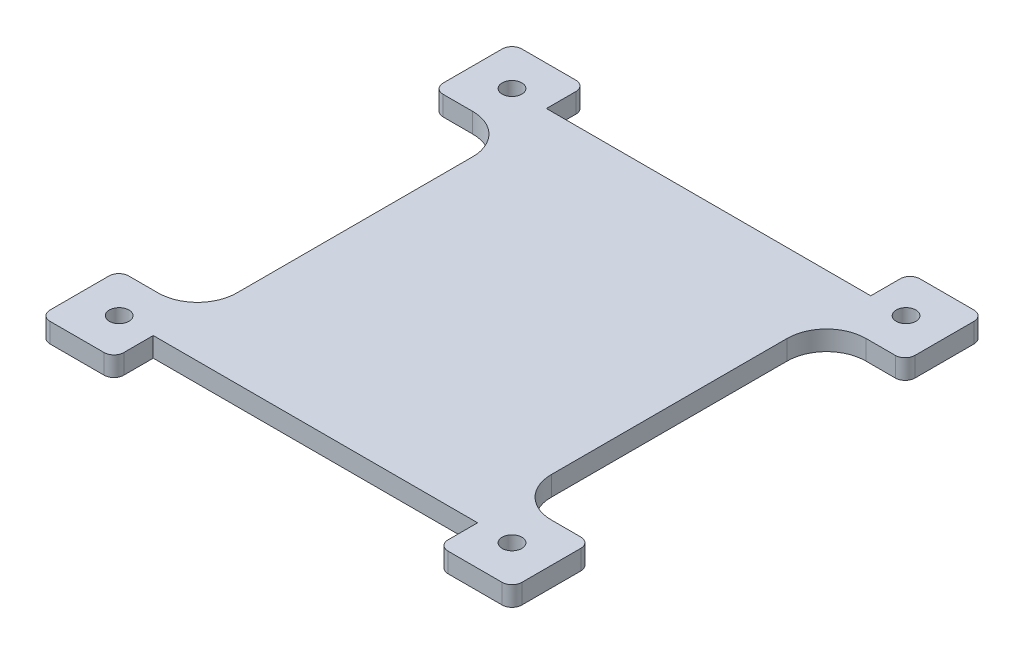
from build123d import *

# Parameters (mm, degrees)
SKETCH1_R           = 3.175
BOSS_EXTRUDE1_DEPTH = 6.35
FILLET1_R           = 12.7
FILLET2_R           = 3.175


with BuildPart() as part:
    # Sketch1 → Boss-Extrude1 (new body)
    with BuildSketch(Plane(origin=(0, 0, 0), x_dir=(1, 0, 0), z_dir=(0, 1, 0))):
        Polygon((-50.8, 50.8), (-50.8, -50.8), (-76.2, -50.8), (-76.2, -76.2), (-52.3875, -76.2), (-52.3875, -63.5), (52.3875, -63.5), (52.3875, -76.2), (76.2, -76.2), (76.2, -50.8), (50.8, -50.8), (50.8, 50.8), (76.2, 50.8), (76.2, 76.2), (52.3875, 76.2), (52.3875, 63.5), (-52.3875, 63.5), (-52.3875, 76.2), (-76.2, 76.2), (-76.2, 50.8), align=None)
        with Locations(Location((-63.54848247, 63.54848247, 0), (0, 0, 270))):
            Circle(SKETCH1_R, mode=Mode.SUBTRACT)
        with Locations(Location((63.645484454, 63.645484454, 0), (0, 0, 270))):
            Circle(SKETCH1_R, mode=Mode.SUBTRACT)
        with Locations(Location((63.54848247, -63.54848247, 0), (0, 0, 270))):
            Circle(SKETCH1_R, mode=Mode.SUBTRACT)
        with Locations(Location((-63.451480485, -63.451480485, 0), (0, 0, 270))):
            Circle(SKETCH1_R, mode=Mode.SUBTRACT)
    extrude(amount=BOSS_EXTRUDE1_DEPTH)

    # Fillet1
    fillet1_edges = [part.edges().sort_by_distance(p)[0] for p in [
        (50.8, 3.175, -50.8),
        (50.8, 3.175, 50.8),
        (-50.8, 3.175, 50.8),
        (-50.8, 3.175, -50.8),
    ]]
    fillet(fillet1_edges, radius=FILLET1_R)

    # Fillet2
    fillet2_edges = [part.edges().sort_by_distance(p)[0] for p in [
        (-76.2, 3.175, -76.2),
        (-52.3875, 3.175, -76.2),
        (52.3875, 3.175, -76.2),
        (76.2, 3.175, -76.2),
        (76.2, 3.175, -50.8),
        (76.2, 3.175, 50.8),
        (76.2, 3.175, 76.2),
        (52.3875, 3.175, 76.2),
        (-52.3875, 3.175, 76.2),
        (-76.2, 3.175, 76.2),
        (-76.2, 3.175, 50.8),
        (-76.2, 3.175, -50.8),
    ]]
    fillet(fillet2_edges, radius=FILLET2_R)


solid = part.part
